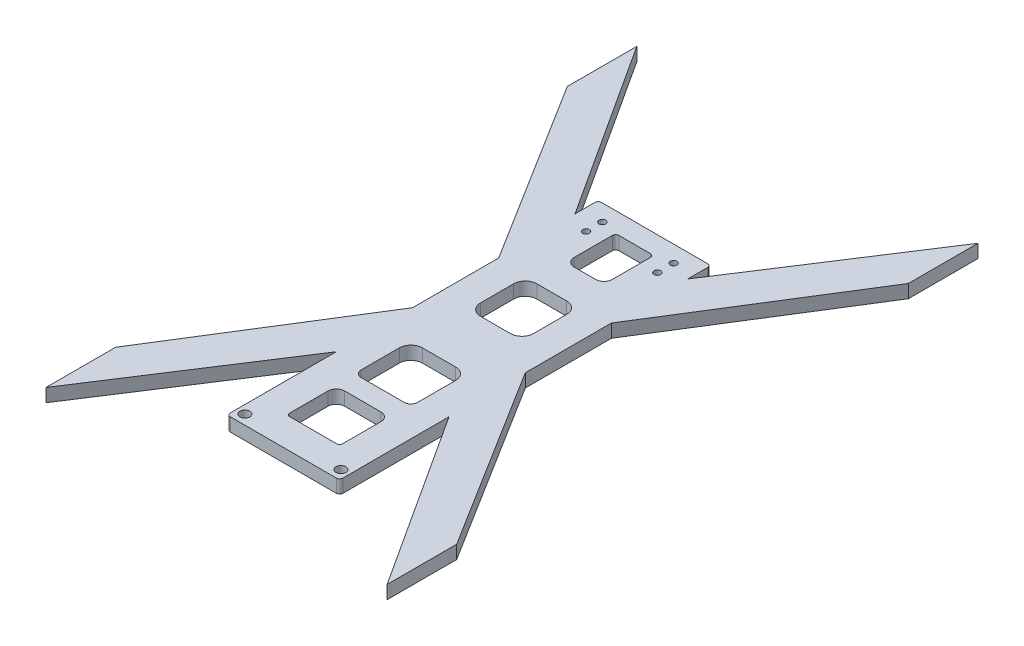
from build123d import *

# Parameters (mm, degrees)
FRAME_SKETCH_R           = 1.5
FRAME_SKETCH_R_2         = 1
FRAME_BOTTOM_PLATE_DEPTH = 4


with BuildPart() as part:
    # Frame Sketch → Frame Bottom Plate (new body)
    with BuildSketch(Plane(origin=(0, 0, 0), x_dir=(1, 0, 0), z_dir=(0, 1, 0))):
        with BuildLine():
            Line((18.280787571, 56.140393786), (-13.719212429, 56.140393786))
            ThreePointArc((-13.719212429, 56.140393786), (-14.42631921, 55.847500567), (-14.719212429, 55.140393786))
            Line((-14.719212429, 55.140393786), (-14.719212429, 49.140393786))
            Line((-14.719212429, 49.140393786), (-49.176727046, 102.27090579))
            Line((-49.176727046, 102.27090579), (-49.176727046, 81.27090579))
            Line((-49.176727046, 81.27090579), (-14.719212429, 26.140393786))
            Line((-14.719212429, 26.140393786), (-14.719212429, 0.140393786))
            Line((-14.719212429, 0.140393786), (-49.176727046, -54.990118218))
            Line((-49.176727046, -54.990118218), (-49.176727046, -75.990118218))
            Line((-49.176727046, -75.990118218), (-14.719212429, -22.859606214))
            Line((-14.719212429, -22.859606214), (-14.719212429, -54.859606214))
            ThreePointArc((-14.719212429, -54.859606214), (-14.42631921, -55.566712995), (-13.719212429, -55.859606214))
            Line((-13.719212429, -55.859606214), (18.280787571, -55.859606214))
            ThreePointArc((18.280787571, -55.859606214), (18.987894353, -55.566712995), (19.280787571, -54.859606214))
            Line((19.280787571, -54.859606214), (19.280787571, -22.859606214))
            Line((19.280787571, -22.859606214), (53.738302189, -75.990118218))
            Line((53.738302189, -75.990118218), (53.738302189, -54.990118218))
            Line((53.738302189, -54.990118218), (19.280787571, 0.140393786))
            Line((19.280787571, 0.140393786), (19.280787571, 26.140393786))
            Line((19.280787571, 26.140393786), (53.738302189, 81.27090579))
            Line((53.738302189, 81.27090579), (53.738302189, 102.27090579))
            Line((53.738302189, 102.27090579), (19.280787571, 49.140393786))
            Line((19.280787571, 49.140393786), (19.280787571, 55.140393786))
            ThreePointArc((19.280787571, 55.140393786), (18.987894353, 55.847500567), (18.280787571, 56.140393786))
        make_face()
        with Locations(Location((-12.219212429, -52.959606214, 0), (0, 0, 270))):
            Circle(FRAME_SKETCH_R, mode=Mode.SUBTRACT)
        with BuildLine():
            Line((9.421181357, -46.859606214), (-4.859606214, -46.859606214))
            ThreePointArc((-4.859606214, -46.859606214), (-5.467439598, -46.607833383), (-5.719212429, -46))
            Line((-5.719212429, -46), (-5.719212429, -34.359606214))
            ThreePointArc((-5.719212429, -34.359606214), (-4.986979382, -32.591839261), (-3.219212429, -31.859606214))
            Line((-3.219212429, -31.859606214), (7.780787571, -31.859606214))
            ThreePointArc((7.780787571, -31.859606214), (9.548554524, -32.591839261), (10.280787571, -34.359606214))
            Line((10.280787571, -34.359606214), (10.280787571, -46))
            ThreePointArc((10.280787571, -46), (10.02901474, -46.607833383), (9.421181357, -46.859606214))
        make_face(mode=Mode.SUBTRACT)
        with Locations(Location((16.780787571, -52.959606214, 0), (0, 0, 270))):
            Circle(FRAME_SKETCH_R, mode=Mode.SUBTRACT)
        with BuildLine():
            ThreePointArc((10.780787571, -23.859606214), (10.195001134, -25.273819777), (8.780787571, -25.859606214))
            Line((8.780787571, -25.859606214), (-4.219212429, -25.859606214))
            ThreePointArc((-4.219212429, -25.859606214), (-5.633425991, -25.273819777), (-6.219212429, -23.859606214))
            Line((-6.219212429, -23.859606214), (-6.219212429, -12.359606214))
            ThreePointArc((-6.219212429, -12.359606214), (-5.194086163, -9.88473248), (-2.719212429, -8.859606214))
            Line((-2.719212429, -8.859606214), (7.280787571, -8.859606214))
            ThreePointArc((7.280787571, -8.859606214), (9.755661306, -9.88473248), (10.780787571, -12.359606214))
            Line((10.780787571, -12.359606214), (10.780787571, -23.859606214))
        make_face(mode=Mode.SUBTRACT)
        with BuildLine():
            Line((6.780787571, 8.140393786), (-2.219212429, 8.140393786))
            ThreePointArc((-2.219212429, 8.140393786), (-4.694086163, 9.165520052), (-5.719212429, 11.640393786))
            Line((-5.719212429, 11.640393786), (-5.719212429, 21.640393786))
            ThreePointArc((-5.719212429, 21.640393786), (-4.694086163, 24.11526752), (-2.219212429, 25.140393786))
            Line((-2.219212429, 25.140393786), (6.780787571, 25.140393786))
            ThreePointArc((6.780787571, 25.140393786), (9.255661306, 24.11526752), (10.280787571, 21.640393786))
            Line((10.280787571, 21.640393786), (10.280787571, 11.640393786))
            ThreePointArc((10.280787571, 11.640393786), (9.255661306, 9.165520052), (6.780787571, 8.140393786))
        make_face(mode=Mode.SUBTRACT)
        with Locations(Location((-8.469212429, 46.240393786, 0), (0, 0, 270))):
            Circle(FRAME_SKETCH_R_2, mode=Mode.SUBTRACT)
        with BuildLine():
            Line((5.530787571, 35.140393786), (-0.969212429, 35.140393786))
            ThreePointArc((-0.969212429, 35.140393786), (-2.736979382, 35.872626833), (-3.469212429, 37.640393786))
            Line((-3.469212429, 37.640393786), (-3.469212429, 49.140393786))
            ThreePointArc((-3.469212429, 49.140393786), (-3.17631921, 49.847500567), (-2.469212429, 50.140393786))
            Line((-2.469212429, 50.140393786), (7.030787571, 50.140393786))
            ThreePointArc((7.030787571, 50.140393786), (7.737894353, 49.847500567), (8.030787571, 49.140393786))
            Line((8.030787571, 49.140393786), (8.030787571, 37.640393786))
            ThreePointArc((8.030787571, 37.640393786), (7.298554524, 35.872626833), (5.530787571, 35.140393786))
        make_face(mode=Mode.SUBTRACT)
        with Locations(Location((-8.469212429, 51.140393786, 0), (0, 0, 270))):
            Circle(FRAME_SKETCH_R_2, mode=Mode.SUBTRACT)
        with Locations(Location((13.030787571, 46.240393786, 0), (0, 0, 270))):
            Circle(FRAME_SKETCH_R_2, mode=Mode.SUBTRACT)
        with Locations(Location((13.030787571, 51.140393786, 0), (0, 0, 270))):
            Circle(FRAME_SKETCH_R_2, mode=Mode.SUBTRACT)
    extrude(amount=FRAME_BOTTOM_PLATE_DEPTH)


solid = part.part
